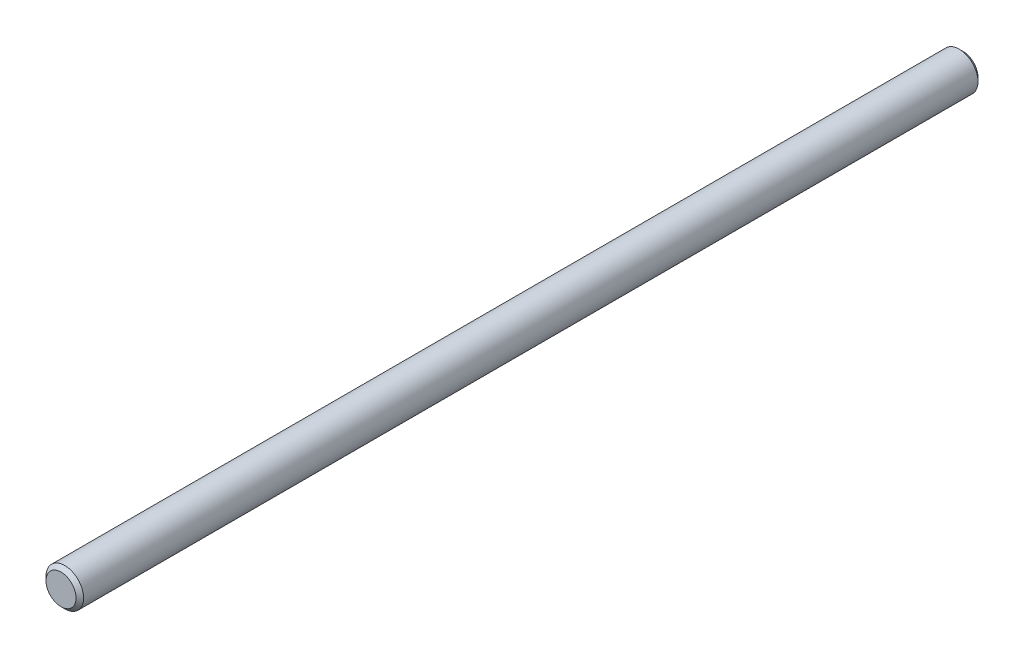
from build123d import *

# Parameters (mm, degrees)
SKETCH1_R      = 3.175
EXTRUDE1_DEPTH = 76.2
CHAMFER1_SIZE  = 0.635


with BuildPart() as part:
    # Sketch1 → Extrude1 (new, symmetric)
    with BuildSketch(Plane.XY):
        with Locations(Location((0, 0, 0), (0, 0, 180))):
            Circle(SKETCH1_R)
    extrude(amount=EXTRUDE1_DEPTH, both=True)

    # Chamfer1
    chamfer1_edges = [part.edges().sort_by_distance(p)[0] for p in [
        (3.175, 0, -76.2),
        (3.175, 0, 76.2),
    ]]
    chamfer(chamfer1_edges, length=CHAMFER1_SIZE)


solid = part.part
